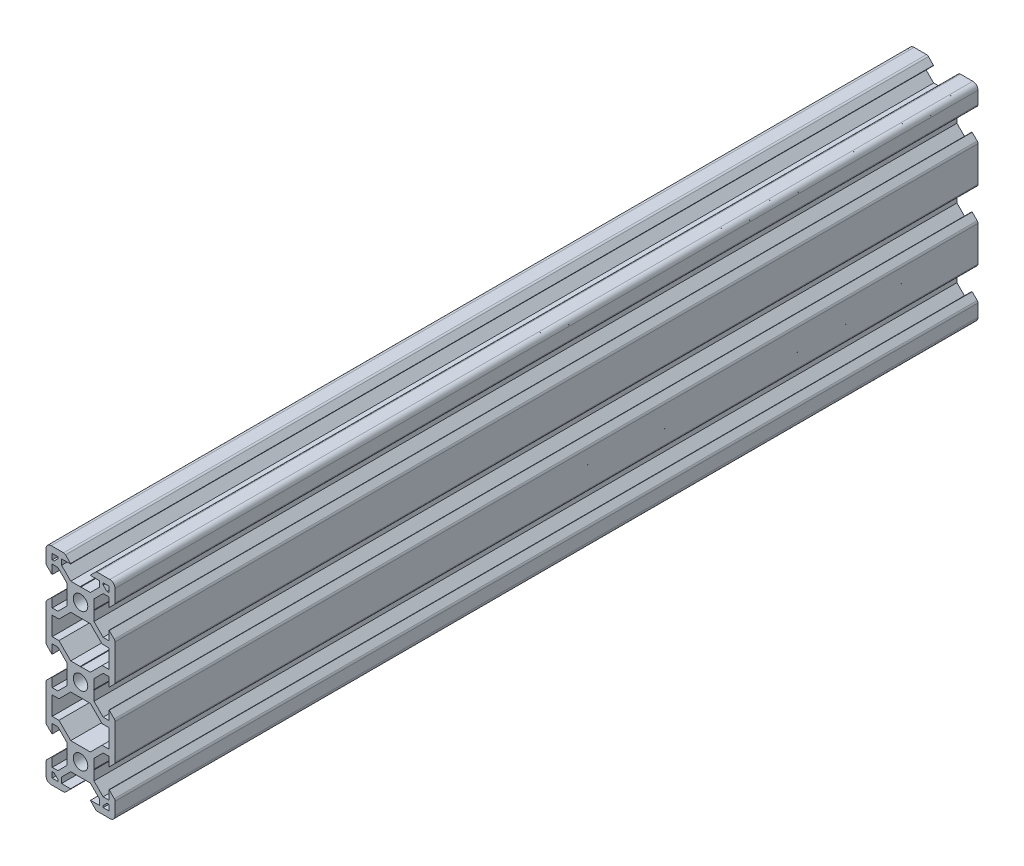
from build123d import *

# Parameters (mm, degrees)
SKETCH6_R           = 2.1
BOSS_EXTRUDE1_DEPTH = 250


with BuildPart() as part:
    # Sketch6 → Boss-Extrude1 (new body)
    with BuildSketch(Plane.XY):
        with BuildLine():
            Line((-0.1, 3.9), (0, 3.8))
            Line((0, 3.8), (0.1, 3.9))
            Line((0.1, 3.9), (2.840365134, 3.9))
            Line((2.840365134, 3.9), (5.5, 6.558825842))
            Line((5.5, 6.558825842), (5.5, 8.197505675))
            Line((5.5, 8.197505675), (2.89, 8.197505675))
            Line((2.89, 8.197505675), (2.89, 8.307505675))
            Line((2.89, 8.307505675), (4.348614357, 9.766120032))
            ThreePointArc((4.348614357, 9.766120032), (4.604908803, 9.937370505), (4.907228714, 9.997505675))
            Line((4.907228714, 9.997505675), (8.5, 9.997505675))
            ThreePointArc((8.5, 9.997505675), (9.560660172, 9.558165846), (10, 8.497505675))
            Line((10, 8.497505675), (10, 4.904734389))
            ThreePointArc((10, 4.904734389), (9.939864831, 4.602414477), (9.768614357, 4.346120032))
            Line((9.768614357, 4.346120032), (8.31, 2.887505675))
            Line((8.31, 2.887505675), (8.2, 2.887505675))
            Line((8.2, 2.887505675), (8.2, 5.497505675))
            Line((8.2, 5.497505675), (6.56, 5.497505675))
            Line((6.56, 5.497505675), (3.9, 2.83831481))
            Line((3.9, 2.83831481), (3.9, 0.1))
            Line((3.9, 0.1), (3.8, 0))
            Line((3.8, 0), (3.9, -0.1))
            Line((3.9, -0.1), (3.9, -2.84))
            Line((3.9, -2.84), (6.56, -5.5))
            Line((6.56, -5.5), (8.21, -5.5))
            Line((8.21, -5.5), (8.21, -2.89))
            Line((8.21, -2.89), (8.31, -2.89))
            Line((8.31, -2.89), (9.765685425, -4.345685425))
            ThreePointArc((9.765685425, -4.345685425), (9.939103626, -4.605224104), (10, -4.91137085))
            Line((10, -4.91137085), (10, -15.08862915))
            ThreePointArc((10, -15.08862915), (9.939103626, -15.394775896), (9.765685425, -15.654314575))
            Line((9.765685425, -15.654314575), (8.31, -17.11))
            Line((8.31, -17.11), (8.21, -17.11))
            Line((8.21, -17.11), (8.21, -14.5))
            Line((8.21, -14.5), (6.56, -14.5))
            Line((6.56, -14.5), (3.9, -17.16))
            Line((3.9, -17.16), (3.9, -19.9))
            Line((3.9, -19.9), (3.8, -20))
            Line((3.8, -20), (3.9, -20.1))
            Line((3.9, -20.1), (3.9, -22.84))
            Line((3.9, -22.84), (6.56, -25.5))
            Line((6.56, -25.5), (8.21, -25.5))
            Line((8.21, -25.5), (8.21, -22.89))
            Line((8.21, -22.89), (8.31, -22.89))
            Line((8.31, -22.89), (9.765685425, -24.345685425))
            ThreePointArc((9.765685425, -24.345685425), (9.939103626, -24.605224104), (10, -24.91137085))
            Line((10, -24.91137085), (10, -35.08862915))
            ThreePointArc((10, -35.08862915), (9.939103626, -35.394775896), (9.765685425, -35.654314575))
            Line((9.765685425, -35.654314575), (8.31, -37.11))
            Line((8.31, -37.11), (8.21, -37.11))
            Line((8.21, -37.11), (8.21, -34.5))
            Line((8.21, -34.5), (6.56, -34.5))
            Line((6.56, -34.5), (3.9, -37.16))
            Line((3.9, -37.16), (3.9, -39.9))
            Line((3.9, -39.9), (3.8, -40))
            Line((3.8, -40), (3.9, -40.1))
            Line((3.9, -40.1), (3.9, -42.83831481))
            Line((3.9, -42.83831481), (6.56, -45.497505675))
            Line((6.56, -45.497505675), (8.2, -45.497505675))
            Line((8.2, -45.497505675), (8.2, -42.887505675))
            Line((8.2, -42.887505675), (8.31, -42.887505675))
            Line((8.31, -42.887505675), (9.768614357, -44.346120032))
            ThreePointArc((9.768614357, -44.346120032), (9.939864831, -44.602414477), (10, -44.904734389))
            Line((10, -44.904734389), (10, -48.497505675))
            ThreePointArc((10, -48.497505675), (9.560660172, -49.558165846), (8.5, -49.997505675))
            Line((8.5, -49.997505675), (4.907228714, -49.997505675))
            ThreePointArc((4.907228714, -49.997505675), (4.604908803, -49.937370505), (4.348614357, -49.766120032))
            Line((4.348614357, -49.766120032), (2.89, -48.307505675))
            Line((2.89, -48.307505675), (2.89, -48.197505675))
            Line((2.89, -48.197505675), (5.5, -48.197505675))
            Line((5.5, -48.197505675), (5.5, -46.558825842))
            Line((5.5, -46.558825842), (2.840365134, -43.9))
            Line((2.840365134, -43.9), (0.1, -43.9))
            Line((0.1, -43.9), (0, -43.8))
            Line((0, -43.8), (-0.1, -43.9))
            Line((-0.1, -43.9), (-2.840365134, -43.9))
            Line((-2.840365134, -43.9), (-5.5, -46.558825842))
            Line((-5.5, -46.558825842), (-5.5, -48.197505675))
            Line((-5.5, -48.197505675), (-2.89, -48.197505675))
            Line((-2.89, -48.197505675), (-2.89, -48.307505675))
            Line((-2.89, -48.307505675), (-4.348614357, -49.766120032))
            ThreePointArc((-4.348614357, -49.766120032), (-4.604908803, -49.937370505), (-4.907228714, -49.997505675))
            Line((-4.907228714, -49.997505675), (-8.5, -49.997505675))
            ThreePointArc((-8.5, -49.997505675), (-9.560660172, -49.558165846), (-10, -48.497505675))
            Line((-10, -48.497505675), (-10, -44.904734389))
            ThreePointArc((-10, -44.904734389), (-9.939864831, -44.602414477), (-9.768614357, -44.346120032))
            Line((-9.768614357, -44.346120032), (-8.31, -42.887505675))
            Line((-8.31, -42.887505675), (-8.2, -42.887505675))
            Line((-8.2, -42.887505675), (-8.2, -45.497505675))
            Line((-8.2, -45.497505675), (-6.56, -45.497505675))
            Line((-6.56, -45.497505675), (-3.9, -42.83831481))
            Line((-3.9, -42.83831481), (-3.9, -40.1))
            Line((-3.9, -40.1), (-3.8, -40))
            Line((-3.8, -40), (-3.9, -39.9))
            Line((-3.9, -39.9), (-3.9, -37.16))
            Line((-3.9, -37.16), (-6.56, -34.5))
            Line((-6.56, -34.5), (-8.21, -34.5))
            Line((-8.21, -34.5), (-8.21, -37.11))
            Line((-8.21, -37.11), (-8.31, -37.11))
            Line((-8.31, -37.11), (-9.765685425, -35.654314575))
            ThreePointArc((-9.765685425, -35.654314575), (-9.939103626, -35.394775896), (-10, -35.08862915))
            Line((-10, -35.08862915), (-10, -24.91137085))
            ThreePointArc((-10, -24.91137085), (-9.939103626, -24.605224104), (-9.765685425, -24.345685425))
            Line((-9.765685425, -24.345685425), (-8.31, -22.89))
            Line((-8.31, -22.89), (-8.21, -22.89))
            Line((-8.21, -22.89), (-8.21, -25.5))
            Line((-8.21, -25.5), (-6.56, -25.5))
            Line((-6.56, -25.5), (-3.9, -22.84))
            Line((-3.9, -22.84), (-3.9, -20.1))
            Line((-3.9, -20.1), (-3.8, -20))
            Line((-3.8, -20), (-3.9, -19.9))
            Line((-3.9, -19.9), (-3.9, -17.16))
            Line((-3.9, -17.16), (-6.56, -14.5))
            Line((-6.56, -14.5), (-8.21, -14.5))
            Line((-8.21, -14.5), (-8.21, -17.11))
            Line((-8.21, -17.11), (-8.31, -17.11))
            Line((-8.31, -17.11), (-9.765685425, -15.654314575))
            ThreePointArc((-9.765685425, -15.654314575), (-9.939103626, -15.394775896), (-10, -15.08862915))
            Line((-10, -15.08862915), (-10, -4.91137085))
            ThreePointArc((-10, -4.91137085), (-9.939103626, -4.605224104), (-9.765685425, -4.345685425))
            Line((-9.765685425, -4.345685425), (-8.31, -2.89))
            Line((-8.31, -2.89), (-8.21, -2.89))
            Line((-8.21, -2.89), (-8.21, -5.5))
            Line((-8.21, -5.5), (-6.56, -5.5))
            Line((-6.56, -5.5), (-3.9, -2.84))
            Line((-3.9, -2.84), (-3.9, -0.1))
            Line((-3.9, -0.1), (-3.8, 0))
            Line((-3.8, 0), (-3.9, 0.1))
            Line((-3.9, 0.1), (-3.9, 2.83831481))
            Line((-3.9, 2.83831481), (-6.56, 5.497505675))
            Line((-6.56, 5.497505675), (-8.2, 5.497505675))
            Line((-8.2, 5.497505675), (-8.2, 2.887505675))
            Line((-8.2, 2.887505675), (-8.31, 2.887505675))
            Line((-8.31, 2.887505675), (-9.768614357, 4.346120032))
            ThreePointArc((-9.768614357, 4.346120032), (-9.939864831, 4.602414477), (-10, 4.904734389))
            Line((-10, 4.904734389), (-10, 8.497505675))
            ThreePointArc((-10, 8.497505675), (-9.560660172, 9.558165846), (-8.5, 9.997505675))
            Line((-8.5, 9.997505675), (-4.907228714, 9.997505675))
            ThreePointArc((-4.907228714, 9.997505675), (-4.604908803, 9.937370505), (-4.348614357, 9.766120032))
            Line((-4.348614357, 9.766120032), (-2.89, 8.307505675))
            Line((-2.89, 8.307505675), (-2.89, 8.197505675))
            Line((-2.89, 8.197505675), (-5.5, 8.197505675))
            Line((-5.5, 8.197505675), (-5.5, 6.558825842))
            Line((-5.5, 6.558825842), (-2.840365134, 3.9))
            Line((-2.840365134, 3.9), (-0.1, 3.9))
        make_face()
        Circle(SKETCH6_R, mode=Mode.SUBTRACT)
        with Locations((0, -20)):
            Circle(SKETCH6_R, mode=Mode.SUBTRACT)
        with Locations(Location((0, -40, 0), (0, 0, 180))):
            Circle(SKETCH6_R, mode=Mode.SUBTRACT)
        Polygon((-7.66, 6.567505675), (-6.57, 7.657505675), (-6.57, 8.197505675), (-8.2, 8.197505675), (-8.2, 6.567505675), align=None, mode=Mode.SUBTRACT)
        Polygon((2.840365134, -3.9), (-2.840365134, -3.9), (-6.25, -7.309634866), (-8.21, -7.309634866), (-8.21, -12.7), (-6.25, -12.7), (-2.85, -16.1), (-0.1, -16.1), (0, -16.2), (0.1, -16.1), (2.85, -16.1), (6.25, -12.7), (8.21, -12.7), (8.21, -7.309634866), (6.25, -7.309634866), align=None, mode=Mode.SUBTRACT)
        Polygon((8.2, 6.567505675), (7.66, 6.567505675), (6.57, 7.657505675), (6.57, 8.197505675), (8.2, 8.197505675), align=None, mode=Mode.SUBTRACT)
        Polygon((7.66, -46.567505675), (6.57, -47.657505675), (6.57, -48.197505675), (8.2, -48.197505675), (8.2, -46.567505675), align=None, mode=Mode.SUBTRACT)
        Polygon((2.840365134, -36.1), (6.25, -32.690365134), (8.21, -32.690365134), (8.21, -27.3), (6.25, -27.3), (2.85, -23.9), (0.1, -23.9), (0, -23.8), (-0.1, -23.9), (-2.85, -23.9), (-6.25, -27.3), (-8.21, -27.3), (-8.21, -32.690365134), (-6.25, -32.690365134), (-2.840365134, -36.1), align=None, mode=Mode.SUBTRACT)
        Polygon((-8.2, -46.567505675), (-7.66, -46.567505675), (-6.57, -47.657505675), (-6.57, -48.197505675), (-8.2, -48.197505675), align=None, mode=Mode.SUBTRACT)
    extrude(amount=-BOSS_EXTRUDE1_DEPTH)


solid = part.part
